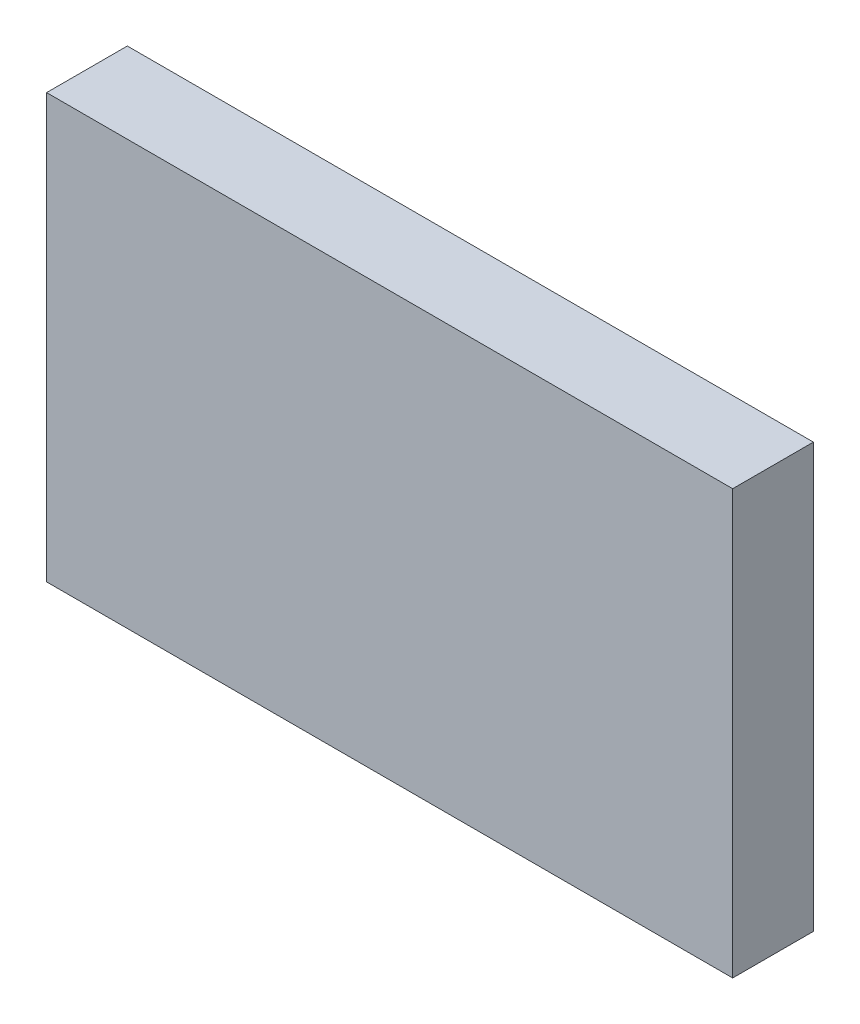
from build123d import *

# Parameters (mm, degrees)
SKETCH1_W           = 170
SKETCH1_H           = 105
BOSS_EXTRUDE1_DEPTH = 20


with BuildPart() as part:
    # Sketch1 → Boss-Extrude1 (new body)
    with BuildSketch(Plane.XY):
        Rectangle(SKETCH1_W, SKETCH1_H)
    extrude(amount=BOSS_EXTRUDE1_DEPTH)


solid = part.part
